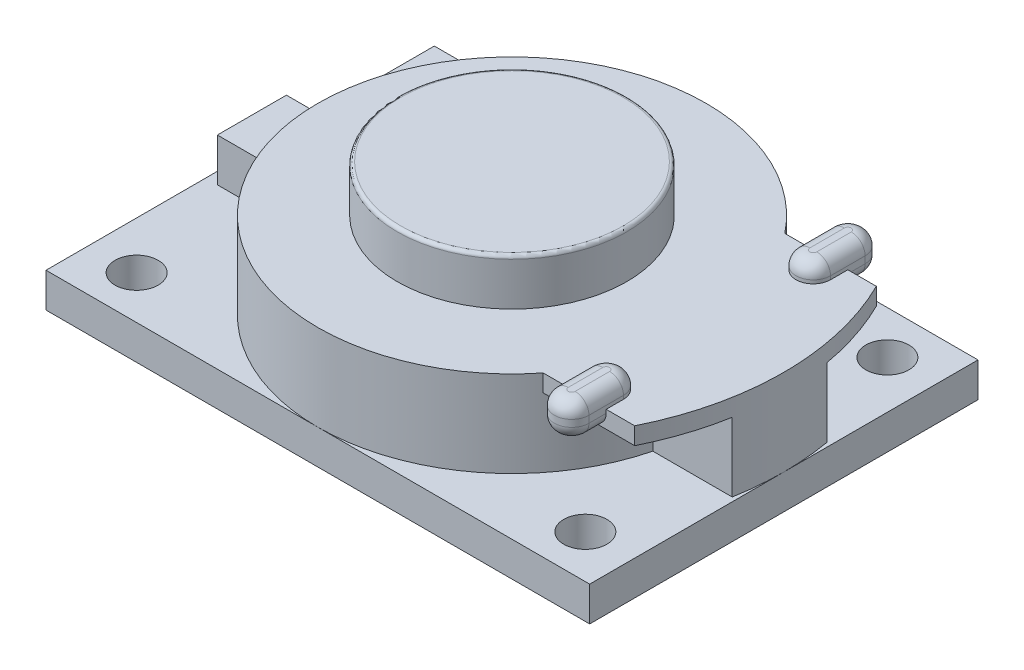
from build123d import *

# Parameters (mm, degrees)
SKETCH1_W           = 40.005
SKETCH1_H           = 28.575
BOSS_EXTRUDE1_DEPTH = 2.54
SKETCH2_R           = 1.5875
CUT_EXTRUDE1_DEPTH  = 25.712026677
SKETCH3_R           = 14.2875
BOSS_EXTRUDE2_DEPTH = 6.35
SKETCH4_R           = 8.4455
BOSS_EXTRUDE3_DEPTH = 3.429
FILLET1_R           = 0.254
SKETCH5_W           = 6.003121546
SKETCH5_H           = 5.08
BOSS_EXTRUDE4_DEPTH = 3.175
BOSS_EXTRUDE5_DEPTH = 6.35
BOSS_EXTRUDE6_DEPTH = 1.27
FILLET2_R           = 1.016
CUT_EXTRUDE2_DEPTH  = 5.08


with BuildPart() as part:
    # Sketch1 → Boss-Extrude1 (new body)
    with BuildSketch(Plane(origin=(0, 0, 0), x_dir=(1, 0, 0), z_dir=(0, 1, 0))):
        Rectangle(SKETCH1_W, SKETCH1_H)
    extrude(amount=BOSS_EXTRUDE1_DEPTH)

    # Sketch2 → Cut-Extrude1 (cut, through all)
    with BuildSketch(Plane(origin=(0, 0, 0), x_dir=(1, 0, 0), z_dir=(0, 1, 0))):
        with Locations(Location((-16.51, 11.1125, 0), (0, 0, 270))):
            Circle(SKETCH2_R)
        with Locations(Location((16.51, 11.1125, 0), (0, 0, 270))):
            Circle(SKETCH2_R)
        with Locations(Location((16.51, -11.1125, 0), (0, 0, 270))):
            Circle(SKETCH2_R)
        with Locations(Location((-16.51, -11.1125, 0), (0, 0, 270))):
            Circle(SKETCH2_R)
    extrude(amount=CUT_EXTRUDE1_DEPTH, mode=Mode.SUBTRACT)

    # Sketch3 → Boss-Extrude2 (add)
    with BuildSketch(Plane(origin=(0, 2.54, 0), x_dir=(1, 0, 0), z_dir=(0, 1, 0))):
        with Locations(Location((0, 0, 0), (0, 0, 270))):
            Circle(SKETCH3_R)
    extrude(amount=BOSS_EXTRUDE2_DEPTH)

    # Sketch4 → Boss-Extrude3 (add)
    with BuildSketch(Plane(origin=(0, 8.89, 0), x_dir=(1, 0, 0), z_dir=(0, 1, 0))):
        with Locations(Location((0, 0, 0), (0, 0, 270))):
            Circle(SKETCH4_R)
    extrude(amount=BOSS_EXTRUDE3_DEPTH)

    # Fillet1
    fillet1_edges = [part.edges().sort_by_distance(p)[0] for p in [
        (0, 12.319, -8.4455),
    ]]
    fillet(fillet1_edges, radius=FILLET1_R)

    # Sketch5 → Boss-Extrude4 (add)
    with BuildSketch(Plane(origin=(0, 2.54, 0), x_dir=(1, 0, 0), z_dir=(0, 1, 0))):
        with Locations((-16.138348766, 0)):
            Rectangle(SKETCH5_W, SKETCH5_H)
    extrude(amount=BOSS_EXTRUDE4_DEPTH)

    # Sketch6 → Boss-Extrude5 (add)
    with BuildSketch(Plane(origin=(0, 2.54, 0), x_dir=(1, 0, 0), z_dir=(0, 1, 0))):
        with BuildLine():
            Line((11.184835996, -8.89), (17.918367846, -8.89))
            ThreePointArc((17.918367846, -8.89), (20.0025, 0), (17.918367846, 8.89))
            Line((17.918367846, 8.89), (11.184835996, 8.89))
            ThreePointArc((11.184835996, 8.89), (14.2875, 0), (11.184835996, -8.89))
        make_face()
    extrude(amount=BOSS_EXTRUDE5_DEPTH)

    # Sketch7 → Boss-Extrude6 (add, symmetric)
    with BuildSketch(Plane(origin=(0, 8.89, 0), x_dir=(1, 0, 0), z_dir=(0, 1, 0))):
        with BuildLine():
            Line((13.281601921, 7.62), (13.281601921, 10.16))
            ThreePointArc((13.281601921, 10.16), (14.551601921, 11.43), (15.821601921, 10.16))
            Line((15.821601921, 10.16), (15.821601921, 7.62))
            ThreePointArc((15.821601921, 7.62), (14.551601921, 6.35), (13.281601921, 7.62))
        make_face()
        with BuildLine():
            Line((13.281601921, -7.62), (13.281601921, -10.16))
            ThreePointArc((13.281601921, -10.16), (14.551601921, -11.43), (15.821601921, -10.16))
            Line((15.821601921, -10.16), (15.821601921, -7.62))
            ThreePointArc((15.821601921, -7.62), (14.551601921, -6.35), (13.281601921, -7.62))
        make_face()
    extrude(amount=BOSS_EXTRUDE6_DEPTH, both=True)

    # Fillet2
    fillet2_edges = [part.edges().sort_by_distance(p)[0] for p in [
        (13.281601921, 7.62, 9.525),
        (14.551601921, 7.62, 11.43),
        (15.821601921, 7.62, 9.525),
        (14.551601921, 10.16, 6.35),
        (13.281601921, 10.16, 8.89),
        (14.551601921, 10.16, 11.43),
        (15.821601921, 10.16, 8.89),
        (15.821601921, 7.62, -9.525),
        (14.551601921, 7.62, -11.43),
        (13.281601921, 7.62, -9.525),
        (14.551601921, 10.16, -6.35),
        (15.821601921, 10.16, -8.89),
        (14.551601921, 10.16, -11.43),
        (13.281601921, 10.16, -8.89),
    ]]
    fillet(fillet2_edges, radius=FILLET2_R)

    # Sketch9 → Cut-Extrude2 (cut)
    with BuildSketch(Plane(origin=(0, 2.54, 0), x_dir=(1, 0, 0), z_dir=(0, 1, 0))):
        with BuildLine():
            Line((0, 14.2875), (31.753560491, 14.2875))
            Line((31.753560491, 14.2875), (31.753560491, 3.4925))
            Line((31.753560491, 3.4925), (13.854064386, 3.4925))
            ThreePointArc((13.854064386, 3.4925), (8.781616096, 11.270131987), (0, 14.2875))
        make_face()
        with BuildLine():
            Line((13.854064386, -3.4925), (31.753560491, -3.4925))
            Line((31.753560491, -3.4925), (31.753560491, -14.2875))
            Line((31.753560491, -14.2875), (0, -14.2875))
            ThreePointArc((0, -14.2875), (8.781616096, -11.270131987), (13.854064386, -3.4925))
        make_face()
    extrude(amount=CUT_EXTRUDE2_DEPTH, mode=Mode.SUBTRACT)


solid = part.part
